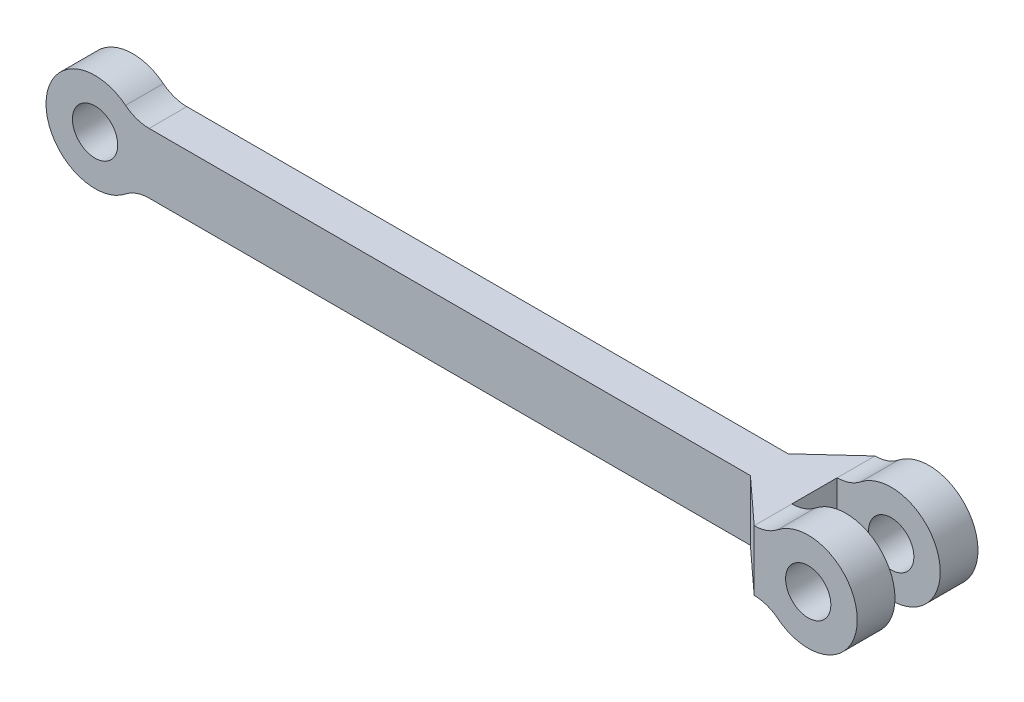
from build123d import *
from build123d.topology import SkipClean

# Parameters (mm, degrees)
SKETCH1_R               = 30
BOSS_EXTRUDE1_DEPTH     = 25
SKETCH3_R               = 30
BOSS_EXTRUDE2_DEPTH     = 80
CUT_EXTRUDE1_DEPTH      = 1074.14957019
CUT_EXTRUDE1_DEPTH_BACK = 1074.14957019
SKETCH4_W               = 136.589105316
SKETCH4_H               = 60


with BuildPart() as part:
    # Sketch1 → Boss-Extrude1 (new, symmetric)
    with BuildSketch(Plane.XY):
        with BuildLine():
            Line((71.589105316, 40), (928.410894684, 40))
            ThreePointArc((928.410894684, 40), (944.895406519, 42.795541847), (959.536592647, 50.869565217))
            ThreePointArc((959.536592647, 50.869565217), (1065, 0), (959.536592647, -50.869565217))
            ThreePointArc((959.536592647, -50.869565217), (944.895406519, -42.795541847), (928.410894684, -40))
            Line((928.410894684, -40), (71.589105316, -40))
            ThreePointArc((71.589105316, -40), (55.104593481, -42.795541847), (40.463407353, -50.869565217))
            ThreePointArc((40.463407353, -50.869565217), (-65, 0), (40.463407353, 50.869565217))
            ThreePointArc((40.463407353, 50.869565217), (55.104593481, 42.795541847), (71.589105316, 40))
        make_face()
        Circle(SKETCH1_R, mode=Mode.SUBTRACT)
        with Locations((1000, 0)):
            Circle(SKETCH1_R, mode=Mode.SUBTRACT)
    extrude(amount=BOSS_EXTRUDE1_DEPTH, both=True)

    # Sketch3 → Boss-Extrude2 (add, symmetric)
    with SkipClean():  # the faces are left unmerged after this step: merging them gives an invalid solid
        with BuildSketch(Plane.XY):
            with BuildLine():
                Line((868.410894684, -40), (928.410894684, -40))
                ThreePointArc((928.410894684, -40), (944.895406519, -42.795541847), (959.536592647, -50.869565217))
                ThreePointArc((959.536592647, -50.869565217), (1065, 0), (959.536592647, 50.869565217))
                ThreePointArc((959.536592647, 50.869565217), (944.895406519, 42.795541847), (928.410894684, 40))
                Line((928.410894684, 40), (868.410894684, 40))
                Line((868.410894684, 40), (868.410894684, -40))
            make_face()
            with Locations((1000, 0)):
                Circle(SKETCH3_R, mode=Mode.SUBTRACT)
        extrude(amount=BOSS_EXTRUDE2_DEPTH, both=True)

    # Sketch4 → Cut-Extrude1 (cut, two sides: drawn at the far end of the back side and taken through both)
    with BuildSketch(Plane(origin=(0, 40, 0), x_dir=(1, 0, 0), z_dir=(0, 1, 0)).offset(-CUT_EXTRUDE1_DEPTH_BACK)):
        Polygon((868.410894684, 25), (928.410894684, 80), (868.410894684, 80), align=None)
        with Locations((996.705447342, 0)):
            Rectangle(SKETCH4_W, SKETCH4_H)
        Polygon((928.410894684, -80), (868.410894684, -80), (868.410894684, -25), align=None)
    extrude(amount=CUT_EXTRUDE1_DEPTH + CUT_EXTRUDE1_DEPTH_BACK, mode=Mode.SUBTRACT)


solid = part.part
